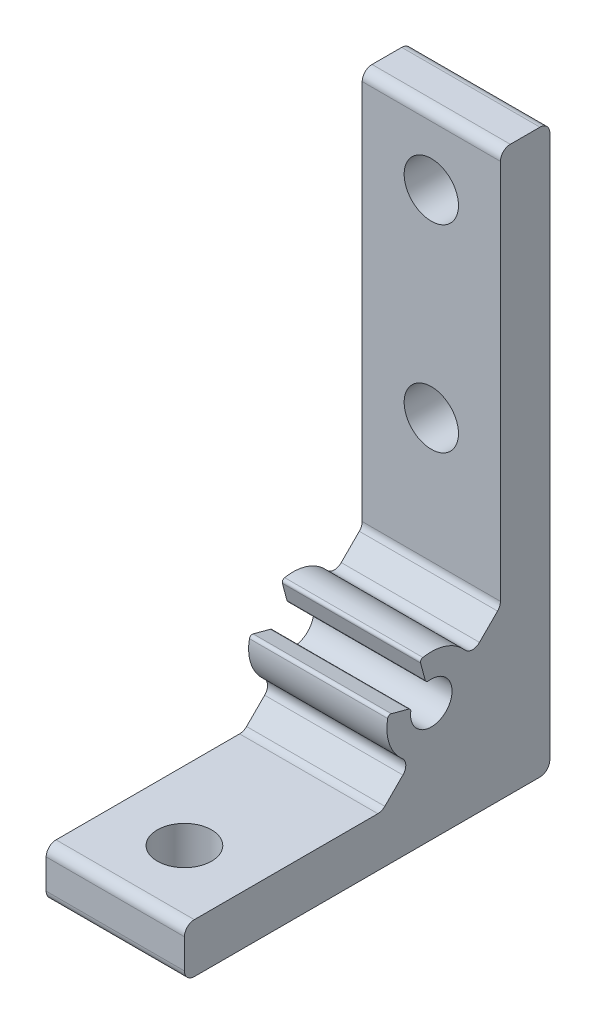
from build123d import *

# Parameters (mm, degrees)
BOSS_EXTRUDE1_DEPTH      = 7
BOSS_EXTRUDE1_DEPTH_BACK = 7
SKETCH2_R                = 2.75
CUT_EXTRUDE1_DEPTH       = 5
SKETCH3_R                = 2.75
CUT_EXTRUDE2_DEPTH       = 5
SKETCH4_R                = 2.75
CUT_EXTRUDE3_DEPTH       = 5


with BuildPart() as part:
    # Sketch1 → Boss-Extrude1 (new, two sides: drawn at the far end of the back side and taken through both)
    with BuildSketch(Plane(origin=(0, 0, 0), x_dir=(0, 0, -1), z_dir=(1, 0, 0)).offset(-BOSS_EXTRUDE1_DEPTH_BACK)):
        with BuildLine():
            Line((-36, 0), (-1, 0))
            ThreePointArc((-1, 0), (-0.292893219, 0.292893219), (0, 1))
            Line((0, 1), (0, 56))
            ThreePointArc((0, 56), (-0.292893219, 56.707106781), (-1, 57))
            Line((-1, 57), (-4, 57))
            ThreePointArc((-4, 57), (-4.707106781, 56.707106781), (-5, 56))
            Line((-5, 56), (-5, 17.414213562))
            ThreePointArc((-5, 17.414213562), (-5.076120467, 17.03153013), (-5.292893219, 16.707106781))
            Line((-5.292893219, 16.707106781), (-7.121957509, 14.878042491))
            ThreePointArc((-7.121957509, 14.878042491), (-7.866746852, 14.585859512), (-8.587416263, 14.93330398))
            ThreePointArc((-8.587416263, 14.93330398), (-10.519537583, 16.249497739), (-12.851234525, 16.418755456))
            ThreePointArc((-12.851234525, 16.418755456), (-13.048766707, 16.283360738), (-13.084263382, 16.046526031))
            Line((-13.084263382, 16.046526031), (-12.616293745, 14.300039569))
            ThreePointArc((-12.616293745, 14.300039569), (-12.492491512, 14.127781044), (-12.285701536, 14.080474617))
            ThreePointArc((-12.285701536, 14.080474617), (-10.515075746, 10.515075773), (-14.080474622, 12.285701498))
            ThreePointArc((-14.080474622, 12.285701498), (-14.127781033, 12.492491496), (-14.300039569, 12.616293745))
            Line((-14.300039569, 12.616293745), (-16.046526031, 13.084263382))
            ThreePointArc((-16.046526031, 13.084263382), (-16.283360688, 13.048766739), (-16.418755434, 12.851234641))
            ThreePointArc((-16.418755434, 12.851234641), (-16.249497766, 10.51953766), (-14.933304014, 8.587416292))
            ThreePointArc((-14.933304014, 8.587416292), (-14.585859513, 7.866746874), (-14.878042491, 7.121957509))
            Line((-14.878042491, 7.121957509), (-16.707106781, 5.292893219))
            ThreePointArc((-16.707106781, 5.292893219), (-17.03153013, 5.076120467), (-17.414213562, 5))
            Line((-17.414213562, 5), (-36, 5))
            ThreePointArc((-36, 5), (-36.707106781, 4.707106781), (-37, 4))
            Line((-37, 4), (-37, 1))
            ThreePointArc((-37, 1), (-36.707106781, 0.292893219), (-36, 0))
        make_face()
    extrude(amount=BOSS_EXTRUDE1_DEPTH + BOSS_EXTRUDE1_DEPTH_BACK)

    # Sketch2 → Cut-Extrude1 (cut)
    with BuildSketch(Plane.XY):
        with Locations((0, 30)):
            Circle(SKETCH2_R)
    extrude(amount=CUT_EXTRUDE1_DEPTH, mode=Mode.SUBTRACT)

    # Sketch3 → Cut-Extrude2 (cut)
    with BuildSketch(Plane.XY):
        with Locations((0, 50)):
            Circle(SKETCH3_R)
    extrude(amount=CUT_EXTRUDE2_DEPTH, mode=Mode.SUBTRACT)

    # Sketch4 → Cut-Extrude3 (cut)
    with BuildSketch(Plane(origin=(0, 0, 0), x_dir=(1, 0, 0), z_dir=(0, 1, 0))):
        with Locations((0, -30)):
            Circle(SKETCH4_R)
    extrude(amount=CUT_EXTRUDE3_DEPTH, mode=Mode.SUBTRACT)


solid = part.part
